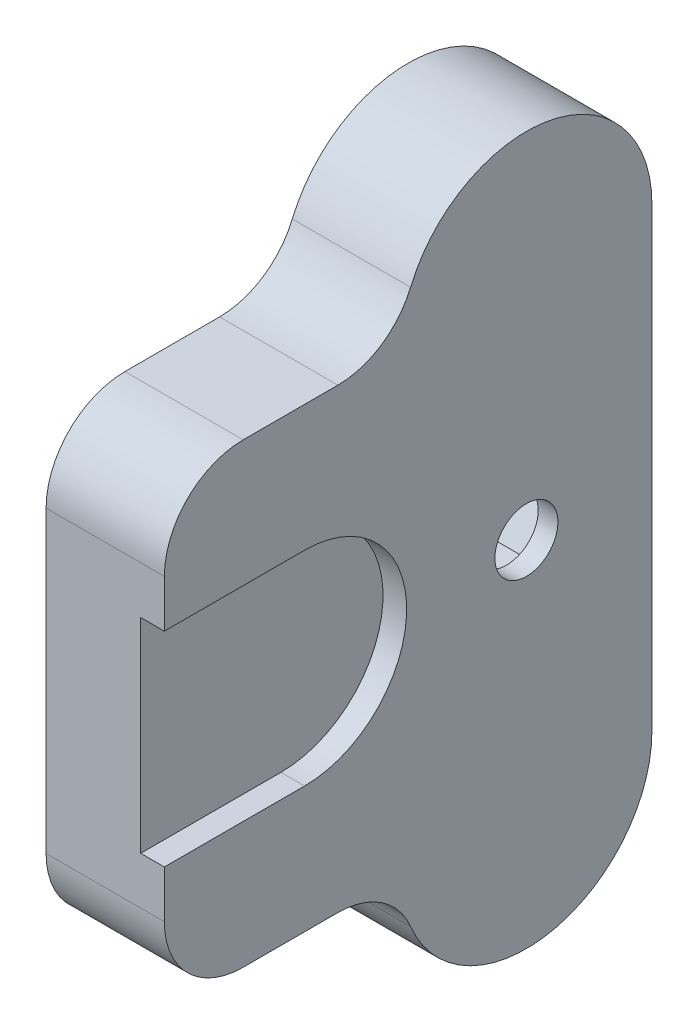
from build123d import *

# Parameters (mm, degrees)
BOSS_EXTRUDE3_DEPTH = 15
SKETCH3_R           = 4
CUT_EXTRUDE3_DEPTH  = 14.0462
CUT_EXTRUDE4_DEPTH  = 3
CUT_EXTRUDE5_START  = -15
CUT_EXTRUDE5_DEPTH  = 12.5


with BuildPart() as part:
    # Sketch1 → Boss-Extrude3 (new body)
    with BuildSketch(Plane.YZ):
        with BuildLine():
            Line((-28.968617751, -12.789334175), (28.968617751, -12.789334175))
            ThreePointArc((28.968617751, -12.789334175), (44.579120821, 0), (35.110840206, 17.821518929))
            ThreePointArc((35.110840206, 17.821518929), (30.644623053, 21.505675602), (28.968617751, 27.047436358))
            Line((28.968617751, 27.047436358), (28.968617751, 39.053986921))
            ThreePointArc((28.968617751, 39.053986921), (26.039685563, 46.125054733), (18.968617751, 49.053986921))
            Line((18.968617751, 49.053986921), (-18.968617751, 49.053986921))
            ThreePointArc((-18.968617751, 49.053986921), (-26.039685563, 46.125054733), (-28.968617751, 39.053986921))
            Line((-28.968617751, 39.053986921), (-28.968617751, 27.047436358))
            ThreePointArc((-28.968617751, 27.047436358), (-30.644623053, 21.505675602), (-35.110840206, 17.821518929))
            ThreePointArc((-35.110840206, 17.821518929), (-44.579120821, 0), (-28.968617751, -12.789334175))
        make_face()
    extrude(amount=BOSS_EXTRUDE3_DEPTH)

    # Sketch3 → Cut-Extrude3 (cut)
    with BuildSketch(Plane.YZ.offset(15)):
        with Locations(Location((0, 3.132326373, 0), (0, 0, 270))):
            Circle(SKETCH3_R)
    extrude(amount=-CUT_EXTRUDE3_DEPTH, mode=Mode.SUBTRACT)

    # Sketch4 → Cut-Extrude4 (cut)
    with BuildSketch(Plane.YZ.offset(15)):
        with BuildLine():
            Line((-12.95, 49.053986921), (-12.95, 31.267703884))
            ThreePointArc((-12.95, 31.267703884), (0, 18.317703884), (12.95, 31.267703884))
            Line((12.95, 31.267703884), (12.95, 49.053986921))
            Line((12.95, 49.053986921), (-12.95, 49.053986921))
        make_face()
    extrude(amount=-CUT_EXTRUDE4_DEPTH, mode=Mode.SUBTRACT)

    # Sketch5 → Cut-Extrude5 (cut, symmetric)
    with BuildSketch(Plane.YZ.offset(15).offset(CUT_EXTRUDE5_START)):
        Polygon((5.466157569, 6.586954394), (-0.258716842, 9.5934717), (-5.724874411, 6.138843679), (-5.466157569, -0.322301647), (0.258716842, -3.328818953), (5.724874411, 0.125809067), align=None)
    extrude(amount=CUT_EXTRUDE5_DEPTH, both=True, mode=Mode.SUBTRACT)


solid = part.part
